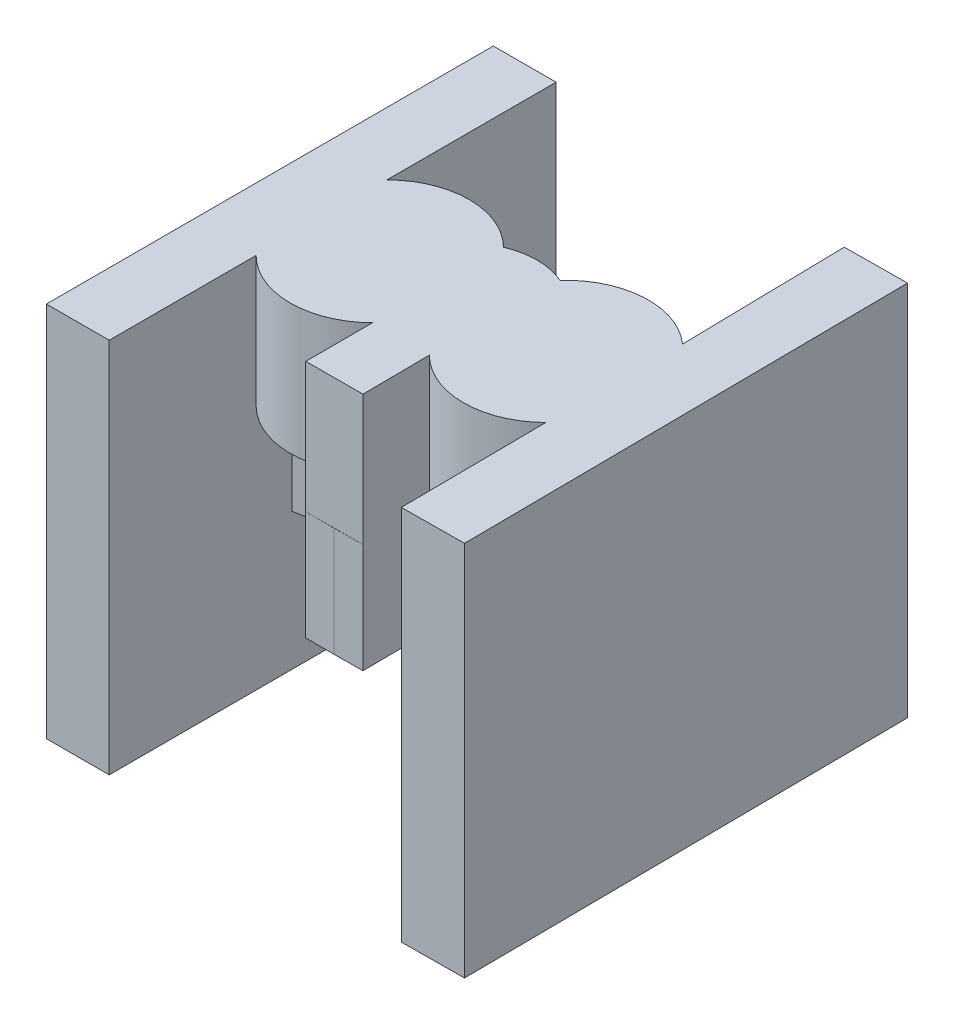
from build123d import *

# Parameters (mm, degrees)
BOSS_EXTRUDE1_DEPTH     = 33
CUT_EXTRUDE1_DEPTH      = 83.954293528
CUT_EXTRUDE1_DEPTH_BACK = 12
SKETCH3_W               = 9.481209811
SKETCH3_H               = 17.021727652
CUT_EXTRUDE2_DEPTH      = 22
SKETCH6_W               = 39.175540074
SKETCH6_H               = 11.416045591
BOSS_EXTRUDE3_DEPTH     = 26
CUT_EXTRUDE3_DEPTH      = 26


with BuildPart() as part:
    # Sketch1 → Boss-Extrude1 (new body)
    with BuildSketch(Plane(origin=(0, 0, 0), x_dir=(1, 0, 0), z_dir=(0, 1, 0))):
        with BuildLine():
            Line((27.99701897, 26.104397373), (30.497019389, 26.104397373))
            Line((30.497019389, 26.104397373), (32.996926828, 26.125958592))
            Line((32.996926828, 26.125958592), (32.946330796, 31.992296402))
            ThreePointArc((32.946330796, 31.992296402), (34.614300355, 33.056919945), (35.86386473, 34.591238885))
            Line((35.86386473, 34.591238885), (40.431539769, 35.753760832))
            Line((40.431539769, 35.753760832), (43.136211097, 35.223788843))
            Line((43.136211097, 35.223788843), (43.274382132, 19.203600277))
            Line((43.274382132, 19.203600277), (48.774177579, 19.251034952))
            Line((48.774177579, 19.251034952), (48.43630867, 58.425118026))
            Line((48.43630867, 58.425118026), (42.936513223, 58.377683351))
            Line((42.936513223, 58.377683351), (43.088196039, 40.790876563))
            Line((43.088196039, 40.790876563), (40.395268448, 39.959225491))
            Line((40.395268448, 39.959225491), (35.888631414, 40.775372904))
            ThreePointArc((35.888631414, 40.775372904), (33.583892359, 43.097075019), (30.420151943, 43.929462788))
            ThreePointArc((30.420151943, 43.929462788), (27.263708108, 43.06982034), (24.979078258, 40.728327384))
            Line((24.979078258, 40.728327384), (20.479647685, 39.873342894))
            Line((20.479647685, 39.873342894), (17.779647685, 40.681737919))
            Line((17.779647685, 40.681737919), (17.779647685, 58.269198812))
            Line((17.779647685, 58.269198812), (12.279647685, 58.269198812))
            Line((12.279647685, 58.269198812), (12.279647685, 19.093658738))
            Line((12.279647685, 19.093658738), (17.779647685, 19.093658738))
            Line((17.779647685, 19.093658738), (17.779647685, 35.114443143))
            Line((17.779647685, 35.114443143), (20.479647685, 35.667721822))
            Line((20.479647685, 35.667721822), (25.057179, 34.544636961))
            ThreePointArc((25.057179, 34.544636961), (26.319929615, 33.021151936), (27.99701897, 31.970953369))
            Line((27.99701897, 31.970953369), (27.99701897, 26.104397373))
        make_face()
    extrude(amount=BOSS_EXTRUDE1_DEPTH)

    # Sketch2 → Cut-Extrude1 (cut, two sides: drawn at the far end of the back side and taken through both)
    with BuildSketch(Plane.XZ.offset(-CUT_EXTRUDE1_DEPTH_BACK)):
        with BuildLine():
            Line((20.479647685, -35.667721822), (17.779647685, -35.114443143))
            Line((17.779647685, -35.114443143), (17.779647685, -40.681737919))
            Line((17.779647685, -40.681737919), (20.479647685, -39.873342894))
            Line((20.479647685, -39.873342894), (24.979078258, -40.728327384))
            ThreePointArc((24.979078258, -40.728327384), (27.263708108, -43.06982034), (30.420151943, -43.929462788))
            ThreePointArc((30.420151943, -43.929462788), (33.576595778, -43.084424394), (35.888631414, -40.775372904))
            Line((35.888631414, -40.775372904), (40.395268448, -39.959225491))
            Line((40.395268448, -39.959225491), (43.088196039, -40.790876563))
            Line((43.088196039, -40.790876563), (43.136211097, -35.223788843))
            Line((43.136211097, -35.223788843), (40.431539769, -35.753760832))
            Line((40.431539769, -35.753760832), (35.86386473, -34.591238885))
            ThreePointArc((35.86386473, -34.591238885), (34.614300355, -33.056919945), (32.946330796, -31.992296402))
            Line((32.946330796, -31.992296402), (32.996926828, -26.125958592))
            Line((32.996926828, -26.125958592), (27.99701897, -26.104397373))
            Line((27.99701897, -26.104397373), (27.99701897, -31.970953369))
            ThreePointArc((27.99701897, -31.970953369), (26.319929615, -33.021151936), (25.057179, -34.544636961))
            Line((25.057179, -34.544636961), (20.479647685, -35.667721822))
        make_face()
    extrude(amount=CUT_EXTRUDE1_DEPTH + CUT_EXTRUDE1_DEPTH_BACK, mode=Mode.SUBTRACT)

    # Sketch3 → Cut-Extrude2 (cut)
    with BuildSketch(Plane.XY.offset(-26.104397373)):
        with Locations((32.737623876, 3.489136174)):
            Rectangle(SKETCH3_W, SKETCH3_H)
    extrude(amount=-CUT_EXTRUDE2_DEPTH, mode=Mode.SUBTRACT)

    # Sketch6 → Boss-Extrude3 (add)
    with BuildSketch(Plane(origin=(17.779647685, 0, 0), x_dir=(0, 0, -1), z_dir=(1, 0, 0))):
        with Locations((38.681428775, 27.291977205)):
            Rectangle(SKETCH6_W, SKETCH6_H)
    extrude(amount=BOSS_EXTRUDE3_DEPTH)

    # Sketch7 → Cut-Extrude3 (cut)
    with BuildSketch(Plane.XZ.offset(-21.583954409)):
        with BuildLine():
            Line((32.946330796, -31.992296402), (32.996926828, -26.125958592))
            Line((32.996926828, -26.125958592), (27.99701897, -26.104397373))
            Line((27.99701897, -26.104397373), (27.99701897, -31.970953369))
            ThreePointArc((27.99701897, -31.970953369), (22.888333328, -29.85486649), (17.779647685, -31.970953369))
            Line((17.779647685, -31.970953369), (17.779647685, -19.093658738))
            Line((17.779647685, -19.093658738), (43.274382132, -19.093658738))
            Line((43.274382132, -19.093658738), (43.779647685, -19.093658738))
            Line((43.779647685, -19.093658738), (43.779647685, -19.207958095))
            Line((43.779647685, -19.207958095), (43.274382132, -19.203600277))
            Line((43.274382132, -19.203600277), (43.164082095, -31.992296402))
            ThreePointArc((43.164082095, -31.992296402), (38.055206446, -29.876130819), (32.946330796, -31.992296402))
        make_face()
        with BuildLine():
            Line((43.205296614, -43.929694297), (42.937448882, -58.269198812))
            Line((42.937448882, -58.269198812), (17.779647685, -58.269198812))
            Line((17.779647685, -58.269198812), (17.779647685, -43.438467364))
            ThreePointArc((17.779647685, -43.438467364), (22.888333328, -45.554554244), (27.99701897, -43.438467364))
            ThreePointArc((27.99701897, -43.438467364), (29.185032105, -43.80020425), (30.420151943, -43.929462788))
            ThreePointArc((30.420151943, -43.929462788), (31.737082796, -43.800165691), (32.996926828, -43.395421786))
            ThreePointArc((32.996926828, -43.395421786), (37.990460261, -45.776780649), (43.205296614, -43.929694297))
        make_face()
    extrude(amount=-CUT_EXTRUDE3_DEPTH, mode=Mode.SUBTRACT)


solid = part.part
